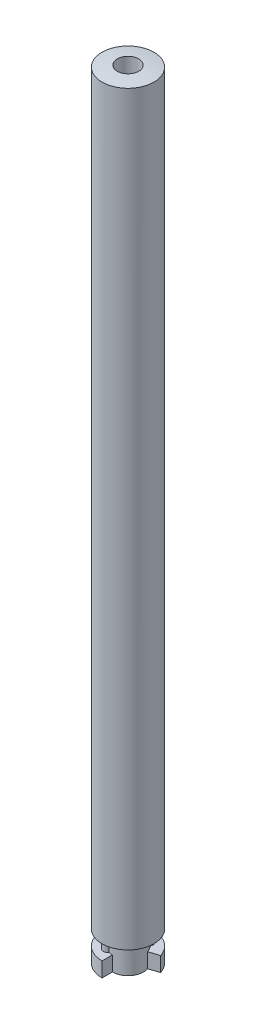
from build123d import *
from build123d.topology import SkipClean

# Parameters (mm, degrees)
SKETCH_1_R          = 3.5
EXTRUDE_1_DEPTH     = 105
CUT_EXTRUDE_1_DEPTH = 2
SKETCH_3_R          = 3.5
SKETCH_3_R_2        = 2.1
CUT_EXTRUDE_3_DEPTH = 2
SKETCH_4_R          = 0.548210007
EXTRUDE_2_DEPTH     = 2
SKETCH_5_R          = 1.45
CUT_EXTRUDE_5_DEPTH = 10


with BuildPart() as part:
    # 草图1 → 凸台-拉伸1 (new body)
    with BuildSketch(Plane(origin=(0, 0, 0), x_dir=(1, 0, 0), z_dir=(0, 1, 0))):
        with Locations(Location((0, 0, 0), (0, 0, 270))):
            Circle(SKETCH_1_R)
    extrude(amount=EXTRUDE_1_DEPTH)

    # 草图2 → 切除-拉伸1 (cut)
    with BuildSketch(Plane.XZ):
        with BuildLine():
            Line((0, 3.5), (0, 2.1))
            ThreePointArc((0, 2.1), (1.698935688, 1.23434903), (1.997218684, -0.648935688))
            Line((1.997218684, -0.648935688), (3.328697807, -1.08155948))
            ThreePointArc((3.328697807, -1.08155948), (3.456909192, -0.547520628), (3.5, 0))
            ThreePointArc((3.5, 0), (2.474873734, 2.474873734), (0, 3.5))
        make_face()
        with BuildLine():
            ThreePointArc((0, -2.1), (-1.698935688, -1.23434903), (-1.997218684, 0.648935688))
            Line((-1.997218684, 0.648935688), (-3.328697807, 1.08155948))
            ThreePointArc((-3.328697807, 1.08155948), (-2.83155948, -2.057248383), (0, -3.5))
            Line((0, -3.5), (0, -2.1))
        make_face()
    extrude(amount=-CUT_EXTRUDE_1_DEPTH, mode=Mode.SUBTRACT)

    # 草图3 → 切除-拉伸3 (cut)
    with SkipClean():  # the faces are left unmerged after this step: merging them gives an invalid solid
        with BuildSketch(Plane.XZ.offset(-2)):
            with Locations(Location((0, 0, 0), (0, 0, 270))):
                Circle(SKETCH_3_R)
            with Locations(Location((0, 0, 0), (0, 0, 270))):
                Circle(SKETCH_3_R_2, mode=Mode.SUBTRACT)
        extrude(amount=-CUT_EXTRUDE_3_DEPTH, mode=Mode.SUBTRACT)

    # 草图4 → 凸台-拉伸2 (add)
    with BuildSketch(Plane(origin=(0, 2, 0), x_dir=(1, 0, 0), z_dir=(0, 1, 0))):
        with BuildLine():
            ThreePointArc((-1.491392248, -1.478427936), (-1.053967002, -1.816357222), (-0.543519995, -2.028444235))
            ThreePointArc((-0.543519995, -2.028444235), (-0.494470754, -1.90238195), (-0.477782325, -1.768146991))
            ThreePointArc((-0.477782325, -1.768146991), (-0.875331586, -1.241045908), (-1.491392248, -1.478427936))
        make_face()
        with BuildLine():
            ThreePointArc((-1.491392248, -1.478427936), (-1.301132932, -2.242311375), (-0.543519995, -2.028444235))
            ThreePointArc((-0.543519995, -2.028444235), (-1.053967002, -1.816357222), (-1.491392248, -1.478427936))
        make_face()
        with Locations((1.025992333, 1.768146991)):
            Circle(SKETCH_4_R)
    extrude(amount=EXTRUDE_2_DEPTH)

    # 草图5 → 切除-拉伸5 (cut)
    with BuildSketch(Plane(origin=(0, 105, 0), x_dir=(1, 0, 0), z_dir=(0, 1, 0))):
        with Locations(Location((0, 0, 0), (0, 0, 270))):
            Circle(SKETCH_5_R)
    extrude(amount=-CUT_EXTRUDE_5_DEPTH, mode=Mode.SUBTRACT)

    # 草图6 → 切除-旋转2 (revolve, cut)
    with BuildSketch(Plane.XY, mode=Mode.PRIVATE) as cut_revolve_2_sk:
        with BuildLine():
            Line((1.203106705, 105), (1.203106705, 104.958820899))
            add(Edge.make_bspline(
                [(3.5, 104.7), (2.737905529, 104.82566733), (1.972274431, 104.911940963), (1.203106705, 104.958820899)],
                knots=[0, 0, 0, 0, 0.657831992, 0.657831992, 0.657831992, 0.657831992], degree=3))
            Line((3.5, 104.7), (3.5, 105))
            Line((3.5, 105), (1.203106705, 105))
        make_face()
    revolve(cut_revolve_2_sk.sketch.rotate(Axis((0, 107.628853611, 0), (0, -1, 0)), 270), axis=Axis((0, 107.628853611, 0), (0, -1, 0)), mode=Mode.SUBTRACT)


solid = part.part
